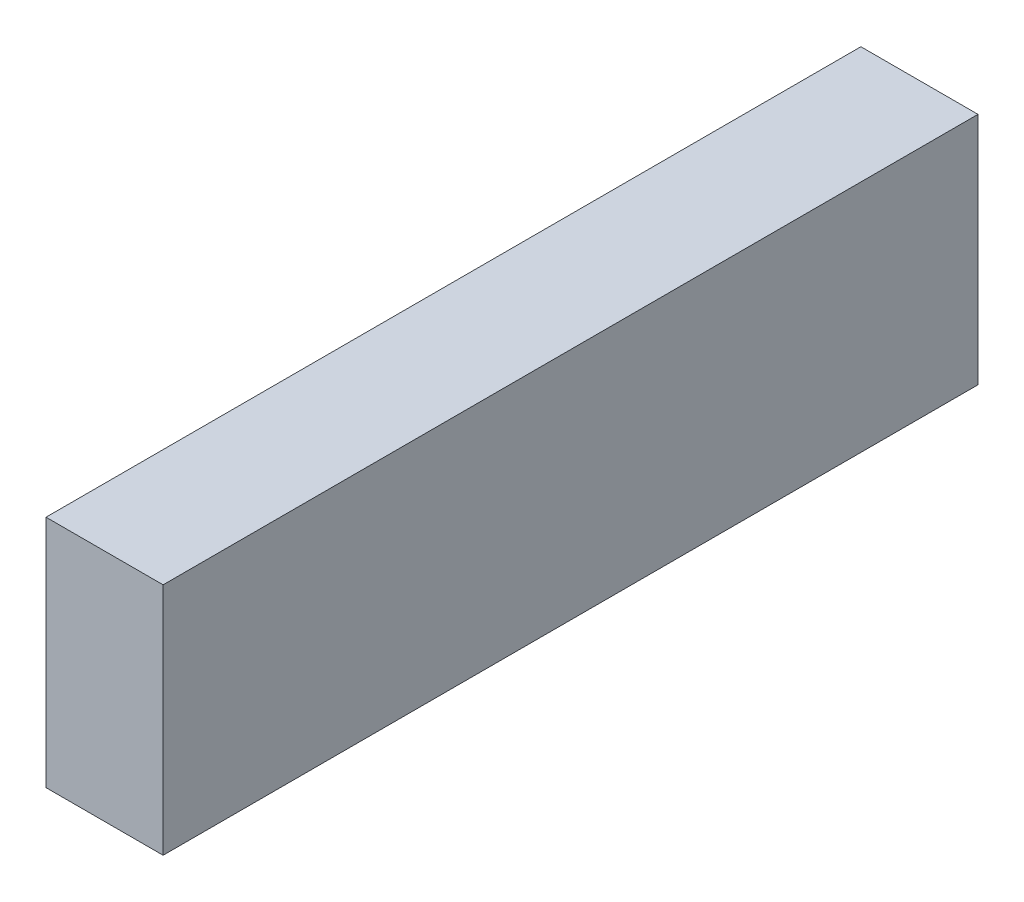
from build123d import *

# Parameters (mm, degrees)
SKETCH_3_W      = 2
SKETCH_3_H      = 13.916053512
EXTRUDE_3_DEPTH = 4


with BuildPart() as part:
    # 草图3 → 凸台-拉伸3 (new body)
    with BuildSketch(Plane(origin=(0, 0, 0), x_dir=(1, 0, 0), z_dir=(0, 1, 0))):
        with Locations((-41.3, 0.041973244)):
            Rectangle(SKETCH_3_W, SKETCH_3_H)
    extrude(amount=EXTRUDE_3_DEPTH)


solid = part.part
